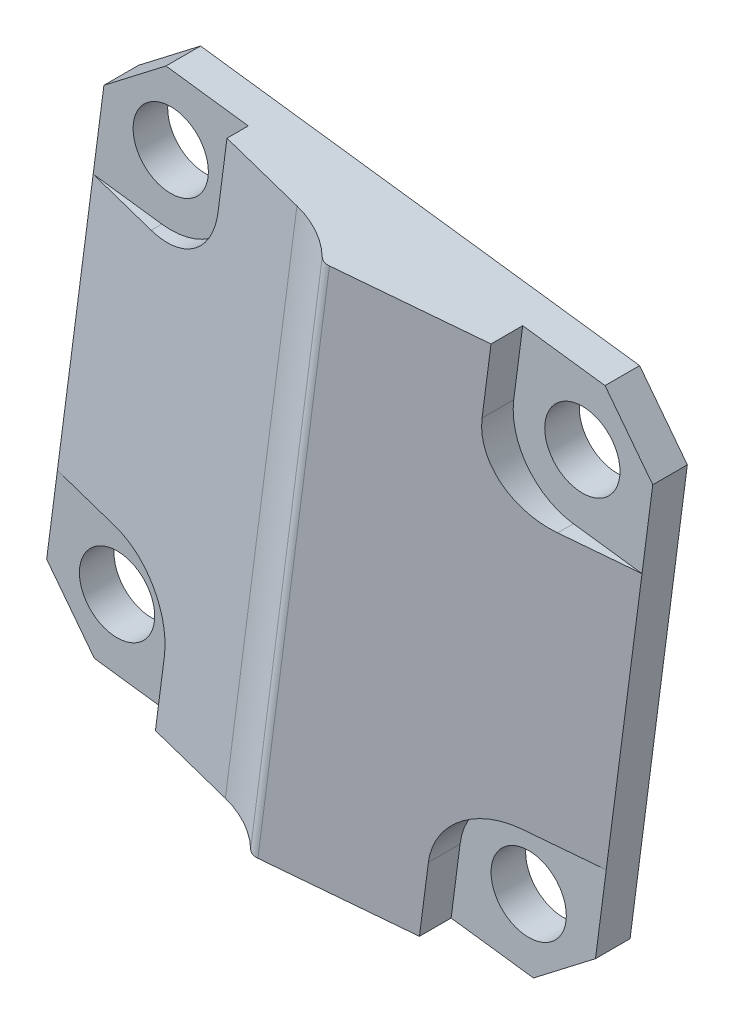
from build123d import *

# Parameters (mm, degrees)
BOSS_EXTRUDE1_DEPTH   = 1.5875
BOSS_EXTRUDE3_DEPTH   = 25.4
FILLET2_R             = 0.508
F_4_CLEARANCE_HOLE1_D = 3.4544
CUT_EXTRUDE3_START    = -6.35
CUT_EXTRUDE3_DEPTH    = 4.7625
CHAMFER1_SIZE         = 2.54


with BuildPart() as part:
    # Sketch2 → Boss-Extrude1 (new body)
    with BuildSketch(Plane.XY):
        Polygon((-37.376757149, -111.329189904), (-34.092160805, -86.142458737), (-8.905429638, -89.427055082), (-12.190025983, -114.613786248), align=None)
    extrude(amount=BOSS_EXTRUDE1_DEPTH)

    # Sketch4 → Boss-Extrude3 (add)
    with BuildSketch(Plane(origin=(-11.61606456, -89.073561748, 0), x_dir=(0.9916035892333672, -0.12931481670521638, 0), z_dir=(0.12931481670521638, 0.9916035892333672, 0))):
        with BuildLine():
            Line((-22.666412757, -1.5875), (-12.484171192, -3.155171915))
            ThreePointArc((-12.484171192, -3.155171915), (-11.111427592, -3.611643646), (-9.966412757, -4.4958))
            Line((-9.966412757, -4.4958), (2.733587243, -1.5875))
            Line((2.733587243, -1.5875), (-22.666412757, -1.5875))
        make_face()
    extrude(amount=-BOSS_EXTRUDE3_DEPTH)

    # Fillet2
    fillet2_edges = [part.edges().sort_by_distance(p)[0] for p in [
        (-23.141093394, -100.378122493, 4.4958),
    ]]
    fillet(fillet2_edges, radius=FILLET2_R)

    # #4 Clearance Hole1 (through all)
    with Locations(Plane(origin=(0, 0, 0), x_dir=(-1, 0, 0), z_dir=(0, 0, -1))):
        with Locations((12.464345577, -92.164821934), (31.354393952, -89.701374676), (33.81784121, -108.591423051), (14.927792835, -111.054870309)):
            Hole(F_4_CLEARANCE_HOLE1_D / 2)

    # Sketch9 → Cut-Extrude3 (cut)
    with BuildSketch(Plane(origin=(0, 0, 0), x_dir=(-1, 0, 0), z_dir=(0, 0, -1)).offset(CUT_EXTRUDE3_START)):
        with BuildLine():
            Line((33.407266667, -105.443081655), (39.974131611, -104.586698171))
            Line((39.974131611, -104.586698171), (39.974131611, -116.083768321))
            Line((39.974131611, -116.083768321), (31.712540611, -117.000176181))
            Line((31.712540611, -117.000176181), (30.669499814, -109.001997594))
            ThreePointArc((30.669499814, -109.001997594), (31.301307616, -106.655529544), (33.407266667, -105.443081655))
        make_face()
        with BuildLine():
            Line((27.163011759, -82.113770632), (35.383316986, -80.880777852))
            Line((35.383316986, -80.880777852), (38.331833439, -91.993332588))
            Line((38.331833439, -91.993332588), (31.764968495, -92.849716072))
            ThreePointArc((31.764968495, -92.849716072), (29.418500445, -92.21790827), (28.206052556, -90.111949219))
            Line((28.206052556, -90.111949219), (27.163011759, -82.113770632))
        make_face()
        with BuildLine():
            Line((12.87492012, -95.31316333), (6.308055176, -96.169546814))
            Line((6.308055176, -96.169546814), (6.308055176, -84.672476664))
            Line((6.308055176, -84.672476664), (14.569646176, -83.756068805))
            Line((14.569646176, -83.756068805), (15.612686973, -91.754247391))
            ThreePointArc((15.612686973, -91.754247391), (14.980879171, -94.100715441), (12.87492012, -95.31316333))
        make_face()
        with BuildLine():
            Line((19.119175028, -118.642474353), (10.898869802, -119.875467134))
            Line((10.898869802, -119.875467134), (7.950353349, -108.762912398))
            Line((7.950353349, -108.762912398), (14.517218292, -107.906528913))
            ThreePointArc((14.517218292, -107.906528913), (16.863686342, -108.538336715), (18.076134231, -110.644295766))
            Line((18.076134231, -110.644295766), (19.119175028, -118.642474353))
        make_face()
    extrude(amount=CUT_EXTRUDE3_DEPTH, mode=Mode.SUBTRACT)

    # Chamfer1
    chamfer1_edges = [part.edges().sort_by_distance(p)[0] for p in [
        (-37.376757149, -111.329189904, 0.79375),
        (-34.092160805, -86.142458737, 0.79375),
        (-8.905429638, -89.427055082, 0.79375),
        (-12.190025983, -114.613786248, 0.79375),
    ]]
    chamfer(chamfer1_edges, length=CHAMFER1_SIZE)


solid = part.part
